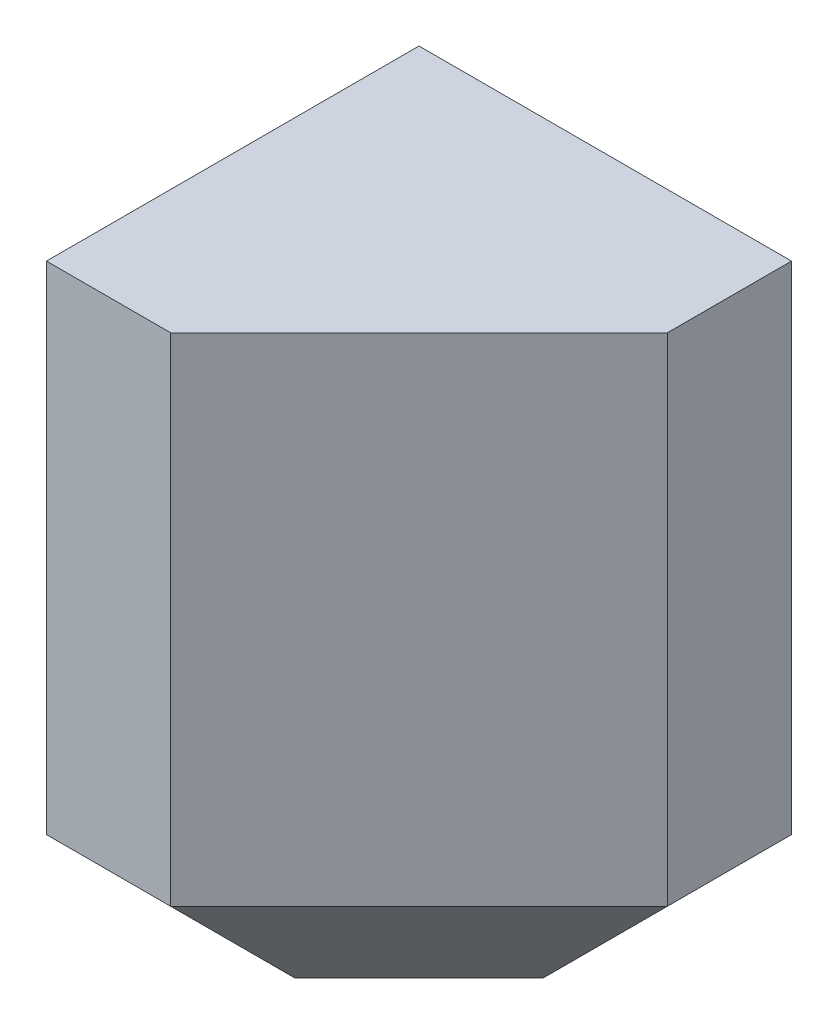
from build123d import *

# Parameters (mm, degrees)
SCHIZZO1_W                   = 30
SCHIZZO1_H                   = 40
ESTRUSIONE_ESTRUSIONE1_DEPTH = 30
SMUSSO1_SIZE                 = 20
ESTRUSIONE_ESTRUSIONE2_DEPTH = 20
FORO_PER_VITE_M5_1_D         = 5.5
FORO_PER_VITE_M5_1_DEPTH     = 13
FORO_PER_VITE_M5_1_TIP       = 1.652366702
FORO_PER_VITE_M5_2_D         = 5.5
FORO_PER_VITE_M5_2_DEPTH     = 13
FORO_PER_VITE_M5_2_TIP       = 1.652366702
SCHIZZO6_W                   = 30
SCHIZZO6_H                   = 30
TAGLIO_ESTRUSIONE1_DEPTH     = 10


with BuildPart() as part:
    # Schizzo1 → Estrusione-Estrusione1 (new body)
    with BuildSketch(Plane.XY):
        with Locations((15, 20)):
            Rectangle(SCHIZZO1_W, SCHIZZO1_H)
    extrude(amount=ESTRUSIONE_ESTRUSIONE1_DEPTH)

    # Smusso1
    smusso1_edges = [part.edges().sort_by_distance(p)[0] for p in [
        (30, 20, 30),
        (30, 0, 15),
        (15, 0, 30),
    ]]
    chamfer(smusso1_edges, length=SMUSSO1_SIZE)

    # Schizzo2 → Estrusione-Estrusione2 (add)
    with BuildSketch(Plane(origin=(0, 40, 0), x_dir=(1, 0, 0), z_dir=(0, 1, 0))):
        Polygon((0, 0), (30, 0), (30, -10), (10, -30), (0, -30), align=None)
    extrude(amount=ESTRUSIONE_ESTRUSIONE2_DEPTH)

    # Foro per Vite M5-1
    with Locations(Plane.ZY):
        with Locations((18, 20), (18, 48)):
            Hole(FORO_PER_VITE_M5_1_D / 2, depth=FORO_PER_VITE_M5_1_DEPTH)
            with Locations((0, 0, -(FORO_PER_VITE_M5_1_DEPTH + FORO_PER_VITE_M5_1_TIP / 2))):  # 118° drill point
                Cone(0, FORO_PER_VITE_M5_1_D / 2, FORO_PER_VITE_M5_1_TIP, mode=Mode.SUBTRACT)

    # Foro per Vite M5-2
    with Locations(Plane(origin=(18, 20, 0), x_dir=(-1, 0, 0), z_dir=(0, 0, -1))):
        with Locations((0, 0), (0, 28)):
            Hole(FORO_PER_VITE_M5_2_D / 2, depth=FORO_PER_VITE_M5_2_DEPTH)
            with Locations((0, 0, -(FORO_PER_VITE_M5_2_DEPTH + FORO_PER_VITE_M5_2_TIP / 2))):  # 118° drill point
                Cone(0, FORO_PER_VITE_M5_2_D / 2, FORO_PER_VITE_M5_2_TIP, mode=Mode.SUBTRACT)

    # Schizzo6 → Taglio-Estrusione1 (cut)
    with BuildSketch(Plane.XZ):
        with Locations((15, 15)):
            Rectangle(SCHIZZO6_W, SCHIZZO6_H)
    extrude(amount=-TAGLIO_ESTRUSIONE1_DEPTH, mode=Mode.SUBTRACT)


solid = part.part
